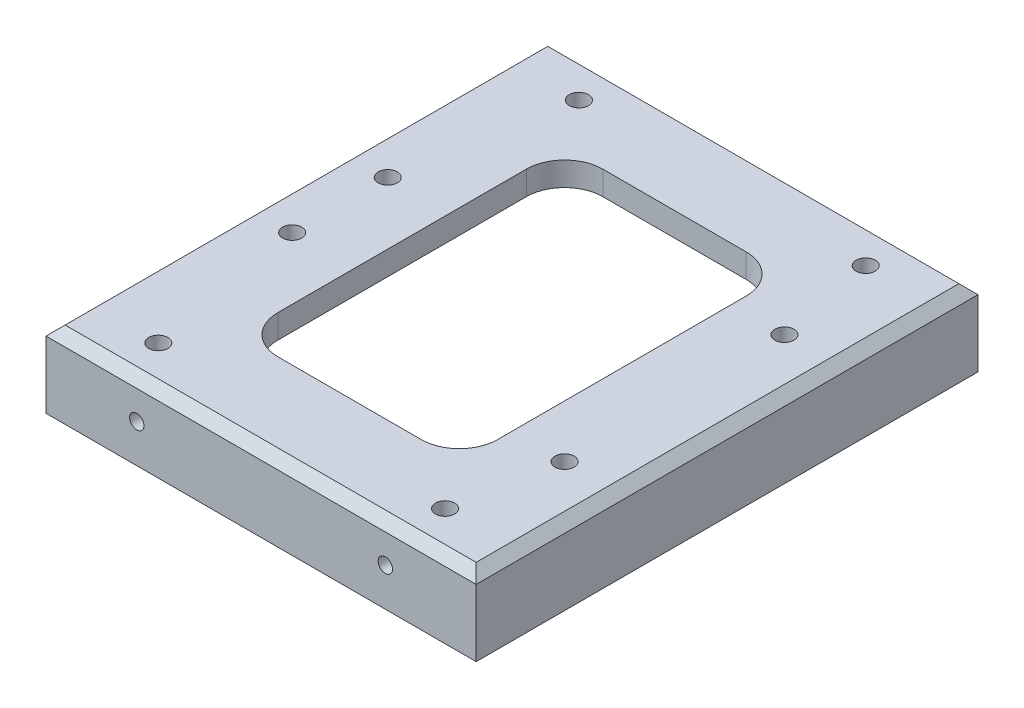
from build123d import *

# Parameters (mm, degrees)
SKETCH1_W           = 90
SKETCH1_H           = 105
BOSS_EXTRUDE1_DEPTH = 16
CHAMFER1_SIZE       = 2
SKETCH3_W           = 80
SKETCH3_H           = 95
CUT_EXTRUDE1_DEPTH  = 11
CUT_EXTRUDE2_DEPTH  = 71.973586636
SKETCH5_R           = 2
CUT_EXTRUDE3_DEPTH  = 71.973586636
SKETCH6_R           = 1.5
CUT_EXTRUDE4_DEPTH  = 5


with BuildPart() as part:
    # Sketch1 → Boss-Extrude1 (new body)
    with BuildSketch(Plane(origin=(0, 0, 0), x_dir=(1, 0, 0), z_dir=(0, 1, 0))):
        Rectangle(SKETCH1_W, SKETCH1_H)
    extrude(amount=BOSS_EXTRUDE1_DEPTH)

    # Chamfer1
    chamfer1_edges = [part.edges().sort_by_distance(p)[0] for p in [
        (-45, 16, 0),
        (0, 16, 52.5),
        (45, 16, 0),
        (0, 16, -52.5),
    ]]
    chamfer(chamfer1_edges, length=CHAMFER1_SIZE)

    # Sketch3 → Cut-Extrude1 (cut)
    with BuildSketch(Plane.XZ):
        Rectangle(SKETCH3_W, SKETCH3_H)
    extrude(amount=-CUT_EXTRUDE1_DEPTH, mode=Mode.SUBTRACT)

    # Sketch4 → Cut-Extrude2 (cut, through all)
    with BuildSketch(Plane(origin=(0, 16, 0), x_dir=(1, 0, 0), z_dir=(0, 1, 0))):
        with BuildLine():
            Line((-15, 34), (15, 34))
            ThreePointArc((15, 34), (20.656854249, 31.656854249), (23, 26))
            Line((23, 26), (23, -26))
            ThreePointArc((23, -26), (20.656854249, -31.656854249), (15, -34))
            Line((15, -34), (-15, -34))
            ThreePointArc((-15, -34), (-20.656854249, -31.656854249), (-23, -26))
            Line((-23, -26), (-23, 26))
            ThreePointArc((-23, 26), (-20.656854249, 31.656854249), (-15, 34))
        make_face()
    extrude(amount=-CUT_EXTRUDE2_DEPTH, mode=Mode.SUBTRACT)

    # Sketch5 → Cut-Extrude3 (cut, through all)
    with BuildSketch(Plane(origin=(0, 16, 0), x_dir=(1, 0, 0), z_dir=(0, 1, 0))):
        with Locations(Location((-30, 44, 0), (0, 0, 270))):
            Circle(SKETCH5_R)
        with Locations(Location((-30, -44, 0), (0, 0, 270))):
            Circle(SKETCH5_R)
        with Locations(Location((30, -44, 0), (0, 0, 270))):
            Circle(SKETCH5_R)
        with Locations(Location((30, 44, 0), (0, 0, 270))):
            Circle(SKETCH5_R)
        with Locations(Location((-36, -10, 0), (0, 0, 270))):
            Circle(SKETCH5_R)
        with Locations(Location((34, 23, 0), (0, 0, 270))):
            Circle(SKETCH5_R)
        with Locations(Location((-36, 10, 0), (0, 0, 270))):
            Circle(SKETCH5_R)
        with Locations(Location((34, -23, 0), (0, 0, 270))):
            Circle(SKETCH5_R)
    extrude(amount=-CUT_EXTRUDE3_DEPTH, mode=Mode.SUBTRACT)

    # Sketch6 → Cut-Extrude4 (cut)
    with BuildSketch(Plane.XY.offset(52.5)):
        with Locations((-26, 8)):
            Circle(SKETCH6_R)
        with Locations((26, 8)):
            Circle(SKETCH6_R)
    extrude(amount=-CUT_EXTRUDE4_DEPTH, mode=Mode.SUBTRACT)


solid = part.part
